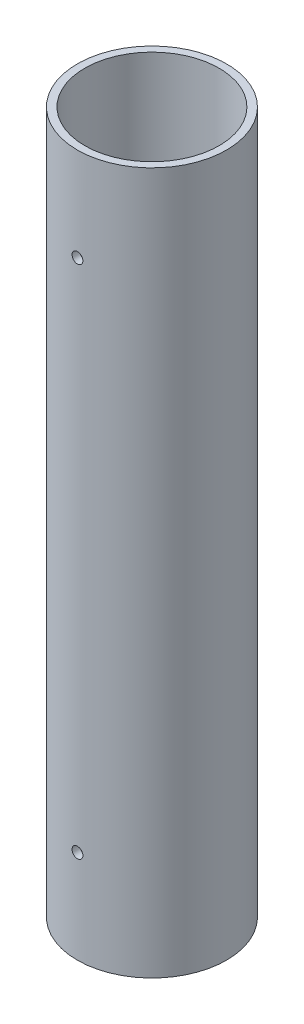
from build123d import *

# Parameters (mm, degrees)
SKETCH_1_R                    = 20
EXTRUDE_1_DEPTH               = 188
CUT_EXTRUDE_2_DEPTH           = 191.115754213
CUT_EXTRUDE_2_DEPTH_BACK      = 191.115754213
SKETCH_2_R                    = 18
SKETCH_5_W                    = 1.45
SKETCH_5_H                    = 20
HOLE_WIZARD_M2_5_1_AT_2_COUNT = 2
HOLE_WIZARD_M2_5_1_AT_2_PITCH = 138


with BuildPart() as part:
    # 스케치1 → 보스-돌출1 (new body)
    with BuildSketch(Plane(origin=(0, 0, 0), x_dir=(1, 0, 0), z_dir=(0, 1, 0))):
        with Locations(Location((0, 0, 0), (0, 0, 270))):
            Circle(SKETCH_1_R)
    extrude(amount=EXTRUDE_1_DEPTH)

    # 스케치2 → 컷-돌출2 (cut, two sides: drawn at the far end of the back side and taken through both)
    with BuildSketch(Plane(origin=(0, 0, 0), x_dir=(1, 0, 0), z_dir=(0, 1, 0)).offset(-CUT_EXTRUDE_2_DEPTH_BACK)):
        with Locations(Location((0, 0, 0), (0, 0, 270))):
            Circle(SKETCH_2_R)
    extrude(amount=CUT_EXTRUDE_2_DEPTH + CUT_EXTRUDE_2_DEPTH_BACK, mode=Mode.SUBTRACT)

    # 스케치5 → M2.5 여유 구멍1 (revolve, cut)
    with BuildSketch(Plane(origin=(0, 163, 0), x_dir=(0, 1, 0), z_dir=(1, 0, 0))):
        with Locations((0.725, 10)):
            Rectangle(SKETCH_5_W, SKETCH_5_H)
    hole_wizard_m2_5_1 = revolve(axis=Axis((0, 163, -6.35), (0, 0, 1)), mode=Mode.SUBTRACT)

    # M2.5 여유 구멍1 at 2: M2.5 여유 구멍1 ×2
    with Locations(*[(0, -i * HOLE_WIZARD_M2_5_1_AT_2_PITCH, 0) for i in range(1, HOLE_WIZARD_M2_5_1_AT_2_COUNT)]):
        add(hole_wizard_m2_5_1, mode=Mode.SUBTRACT)


solid = part.part
